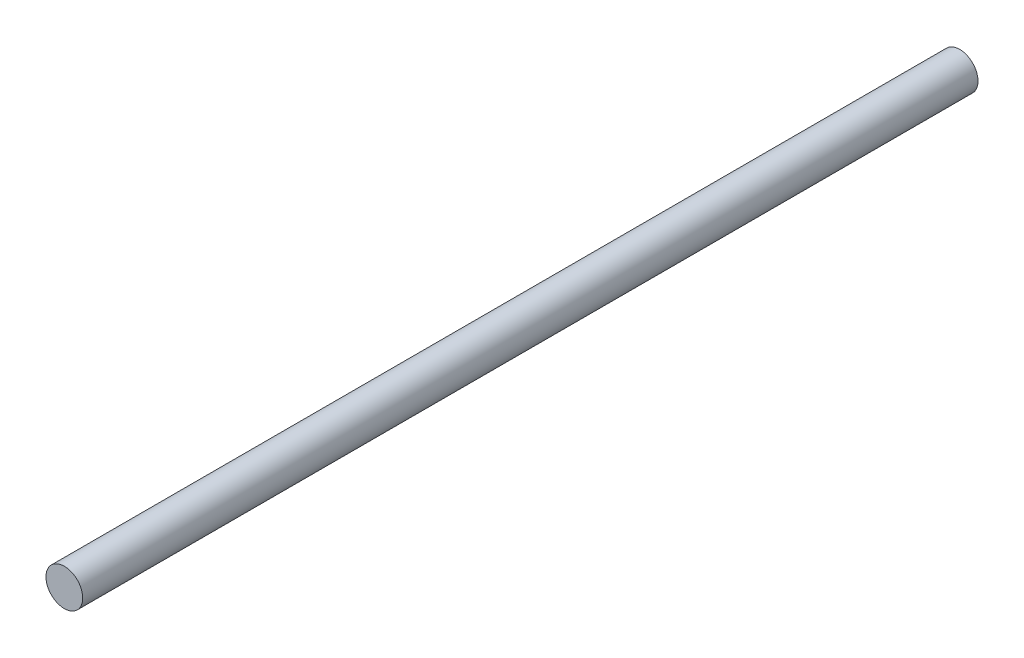
from build123d import *

# Parameters (mm, degrees)
CROQUIS1_R              = 4
SALIENTE_EXTRUIR1_DEPTH = 195


with BuildPart() as part:
    # Croquis1 → Saliente-Extruir1 (new body)
    with BuildSketch(Plane.XY):
        Circle(CROQUIS1_R)
    extrude(amount=SALIENTE_EXTRUIR1_DEPTH)


solid = part.part
